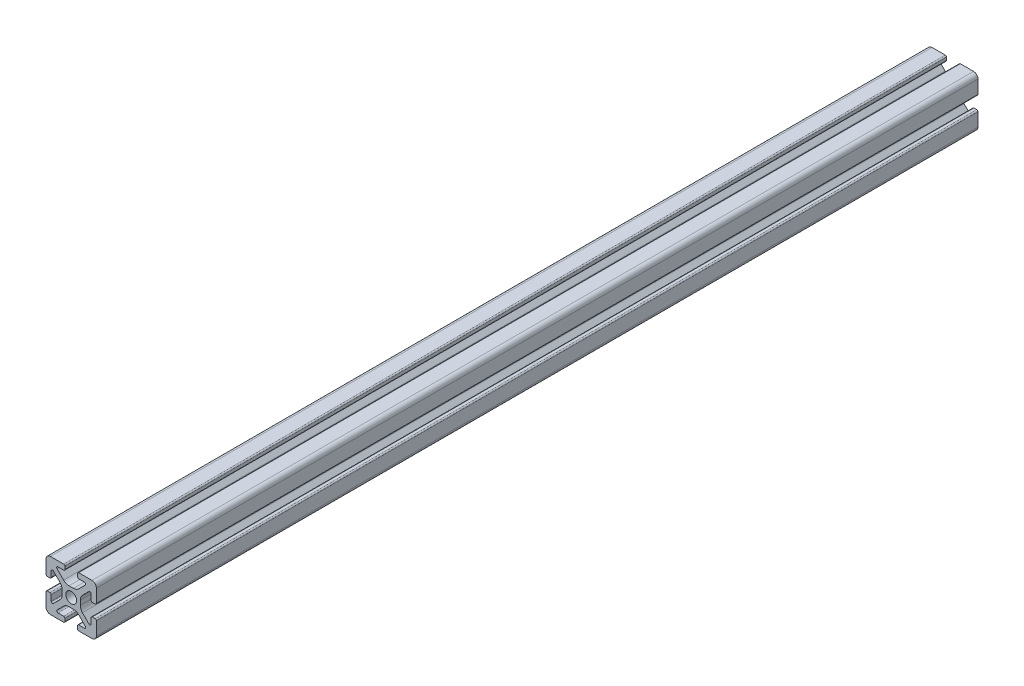
from build123d import *

# Parameters (mm, degrees)
BOSS_EXTRUDE1_DEPTH = 175


with BuildPart() as part:
    # Sketch4 → Boss-Extrude1 (new, symmetric)
    with BuildSketch(Plane.XY):
        with BuildLine():
            Line((3, -10), (8.25, -10))
            ThreePointArc((8.25, -10), (9.487436867, -9.487436867), (10, -8.25))
            Line((10, -8.25), (10, -3))
            ThreePointArc((10, -3), (9.853553391, -2.646446609), (9.5, -2.5))
            Line((9.5, -2.5), (8.424621202, -2.5))
            ThreePointArc((8.424621202, -2.5), (8.071067812, -2.646446609), (7.924621202, -3))
            Line((7.924621202, -3), (7.924621202, -5.25))
            ThreePointArc((7.924621202, -5.25), (7.615962919, -5.711939766), (7.071067812, -5.603553391))
            Line((7.071067812, -5.603553391), (4.478679656, -3.011165235))
            ThreePointArc((4.478679656, -3.011165235), (3.828361402, -2.037895189), (3.6, -0.889844892))
            Line((3.6, -0.889844892), (3.6, 0))
            Line((3.6, 0), (2.15, 0))
            ThreePointArc((2.15, 0), (1.52027958, -1.52027958), (0, -2.15))
            Line((0, -2.15), (0, -3.6))
            Line((0, -3.6), (0.889844892, -3.6))
            ThreePointArc((0.889844892, -3.6), (2.037895189, -3.828361402), (3.011165235, -4.478679656))
            Line((3.011165235, -4.478679656), (5.603553391, -7.071067812))
            ThreePointArc((5.603553391, -7.071067812), (5.711939766, -7.615962919), (5.25, -7.924621202))
            Line((5.25, -7.924621202), (3, -7.924621202))
            ThreePointArc((3, -7.924621202), (2.646446609, -8.071067812), (2.5, -8.424621202))
            Line((2.5, -8.424621202), (2.5, -9.5))
            ThreePointArc((2.5, -9.5), (2.646446609, -9.853553391), (3, -10))
        make_face()
    extrude(amount=BOSS_EXTRUDE1_DEPTH, both=True)

    # Mirror1: part across plane


with BuildPart() as part_1:
    add(part.part)
    add(part.part.mirror(Plane(origin=(0, 0, 0), x_dir=(0, 0, 1), z_dir=(1, 0, 0))))

    # Mirror2: part across plane


with BuildPart() as part_2:
    add(part_1.part)
    add(part_1.part.mirror(Plane.ZX))


solid = part_2.part
